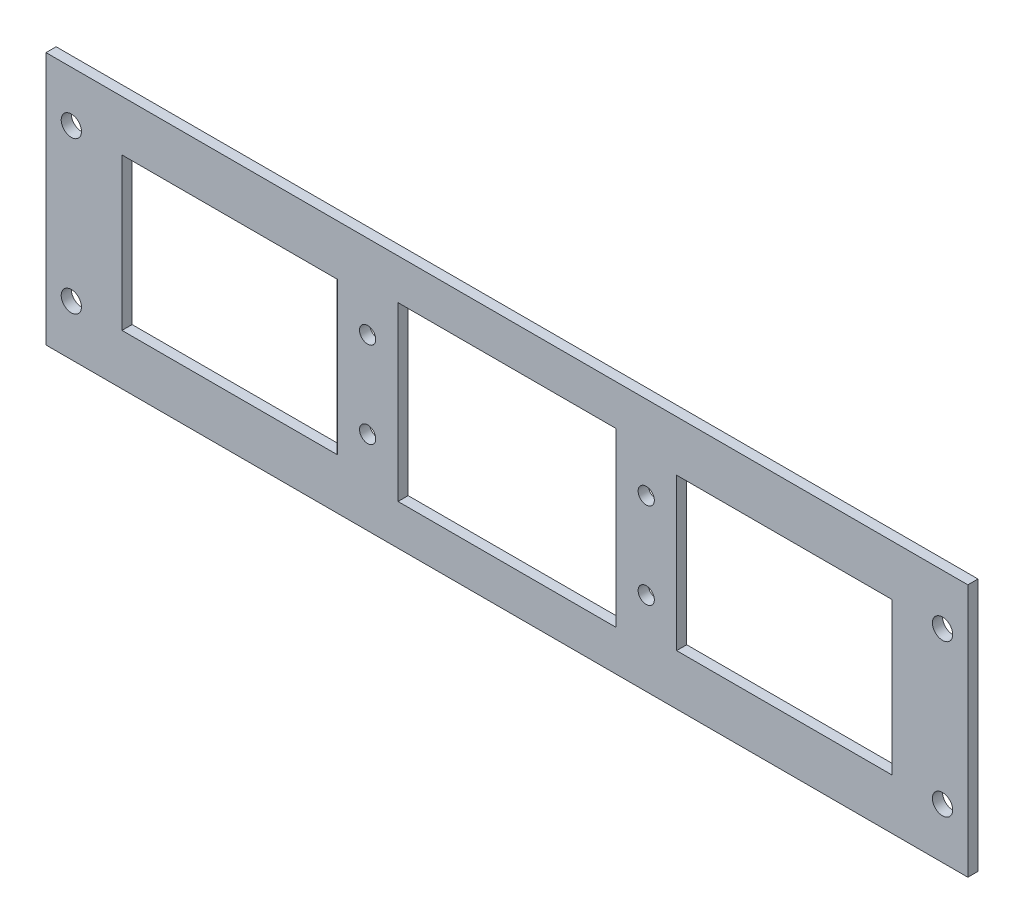
from build123d import *

# Parameters (mm, degrees)
SKETCH_1_W          = 182
SKETCH_1_H          = 50
SKETCH_1_R          = 2
EXTRUDE_1_DEPTH     = 2
SKETCH_2_R          = 1.6
CUT_EXTRUDE_1_DEPTH = 95.392796335
SKETCH_3_W          = 43
SKETCH_3_H          = 34
SKETCH_3_W_2        = 42.5
SKETCH_3_H_2        = 30
CUT_EXTRUDE_2_DEPTH = 95.392796335


with BuildPart() as part:
    # 草图1 → 凸台-拉伸1 (new body)
    with BuildSketch(Plane.XY):
        Rectangle(SKETCH_1_W, SKETCH_1_H)
        with Locations((-86, 15)):
            Circle(SKETCH_1_R, mode=Mode.SUBTRACT)
        with Locations((86, 15)):
            Circle(SKETCH_1_R, mode=Mode.SUBTRACT)
        with Locations((-86, -15)):
            Circle(SKETCH_1_R, mode=Mode.SUBTRACT)
        with Locations((86, -15)):
            Circle(SKETCH_1_R, mode=Mode.SUBTRACT)
    extrude(amount=EXTRUDE_1_DEPTH)

    # 草图2 → 切除-拉伸1 (cut, through all)
    with BuildSketch(Plane.XY.offset(2)):
        with Locations((-27.5, 8.5)):
            Circle(SKETCH_2_R)
        with Locations((-27.5, -8.5)):
            Circle(SKETCH_2_R)
        with Locations((27.5, 8.5)):
            Circle(SKETCH_2_R)
        with Locations((27.5, -8.5)):
            Circle(SKETCH_2_R)
    extrude(amount=-CUT_EXTRUDE_1_DEPTH, mode=Mode.SUBTRACT)

    # 草图3 → 切除-拉伸2 (cut, through all)
    with BuildSketch(Plane.XY.offset(2)):
        Rectangle(SKETCH_3_W, SKETCH_3_H)
        with Locations((-54.75, 0)):
            Rectangle(SKETCH_3_W_2, SKETCH_3_H_2)
        with Locations((54.75, 0)):
            Rectangle(SKETCH_3_W_2, SKETCH_3_H_2)
    extrude(amount=-CUT_EXTRUDE_2_DEPTH, mode=Mode.SUBTRACT)


solid = part.part
